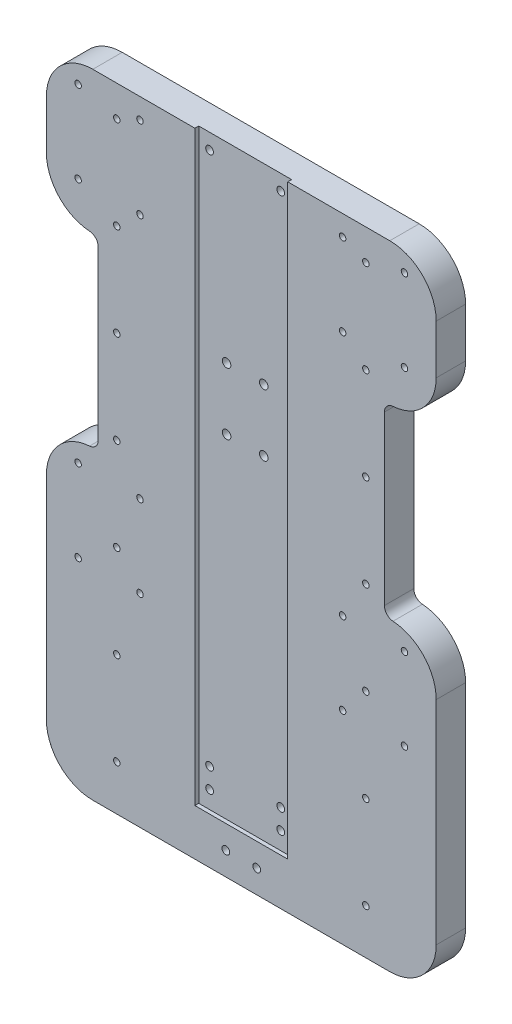
from build123d import *

# Parameters (mm, degrees)
SCHIZZO1_W                       = 252
SCHIZZO1_H                       = 500
ESTRUSIONE_ESTRUSIONE1_DEPTH     = 19
SCHIZZO3_W                       = 60
SCHIZZO3_H                       = 2.5
TAGLIO_ESTRUSIONE1_DEPTH         = 516.981588819
TAP_DRILL_FOR_M5_TAP2_AT_2_COUNT = 2
TAP_DRILL_FOR_M5_TAP2_AT_2_PITCH = 60
TAP_DRILL_FOR_M5_TAP2_AT_3_COUNT = 2
TAP_DRILL_FOR_M5_TAP2_AT_3_PITCH = 120
TAP_DRILL_FOR_M5_TAP2_AT_4_COUNT = 2
TAP_DRILL_FOR_M5_TAP2_AT_4_PITCH = 180
TAP_DRILL_FOR_M5_TAP2_AT_5_COUNT = 2
TAP_DRILL_FOR_M5_TAP2_AT_5_PITCH = 240
TAP_DRILL_FOR_M5_TAP2_AT_6_COUNT = 2
TAP_DRILL_FOR_M5_TAP2_AT_6_PITCH = 300
TAP_DRILL_FOR_M5_TAP2_AT_7_COUNT = 2
TAP_DRILL_FOR_M5_TAP2_AT_7_PITCH = 360
TAP_DRILL_FOR_M5_TAP1_AT_2_COUNT = 2
TAP_DRILL_FOR_M5_TAP1_AT_2_PITCH = 40
TAP_DRILL_FOR_M5_TAP1_AT_3_COUNT = 2
TAP_DRILL_FOR_M5_TAP1_AT_3_PITCH = 53
TAP_DRILL_FOR_M5_TAP1_AT_4_COUNT = 2
TAP_DRILL_FOR_M5_TAP1_AT_4_PITCH = 66.400301204
TAP_DRILL_FOR_M5_TAP1_AT_5_COUNT = 2
TAP_DRILL_FOR_M5_TAP1_AT_5_PITCH = 265.000000001
TAP_DRILL_FOR_M5_TAP1_AT_6_COUNT = 2
TAP_DRILL_FOR_M5_TAP1_AT_6_PITCH = 268.001865666
TAP_DRILL_FOR_M5_TAP1_AT_7_COUNT = 2
TAP_DRILL_FOR_M5_TAP1_AT_7_PITCH = 215.740584963
TAP_DRILL_FOR_M5_TAP1_AT_8_COUNT = 2
TAP_DRILL_FOR_M5_TAP1_AT_8_PITCH = 212.000000001
TAP_DRILL_FOR_M6_TAP4_D          = 5
TAP_DRILL_FOR_M6_TAP4_DEPTH      = 36.6
TAP_DRILL_FOR_M6_TAP4_TIP        = 1.502151548
SKETCH16_W                       = 252
SKETCH16_H                       = 158.679931771
CUT_EXTRUDE1_DEPTH               = 28
SKETCH26_W                       = 60
SKETCH26_H                       = 30
BOSS_EXTRUDE1_DEPTH              = 2.5
M5_CLEARANCE_HOLE1_D             = 5.5
TAP_DRILL_FOR_M6_TAP2_D          = 5
TAP_DRILL_FOR_M6_TAP2_DEPTH      = 30
TAP_DRILL_FOR_M6_TAP2_TIP        = 1.502151548
TAP_DRILL_FOR_M6_TAP3_D          = 5
SKETCH27_W                       = 33.5
SKETCH27_H                       = 120.140011943
CUT_EXTRUDE2_DEPTH               = 76.991082214
FILLET1_R                        = 30
FILLET2_R                        = 30
FILLET3_R                        = 6
SKETCH28_W                       = 64
SKETCH28_H                       = 56
CUT_EXTRUDE3_DEPTH               = 2


with BuildPart() as part:
    # Schizzo1 → Estrusione-Estrusione1 (new body)
    with BuildSketch(Plane.XY):
        Rectangle(SCHIZZO1_W, SCHIZZO1_H)
    extrude(amount=ESTRUSIONE_ESTRUSIONE1_DEPTH)

    # Schizzo3 → Taglio-Estrusione1 (cut, through all)
    with BuildSketch(Plane(origin=(0, 250, 0), x_dir=(1, 0, 0), z_dir=(0, 1, 0))):
        with Locations((0, -17.75)):
            Rectangle(SCHIZZO3_W, SCHIZZO3_H)
    extrude(amount=-TAGLIO_ESTRUSIONE1_DEPTH, mode=Mode.SUBTRACT)

    # Sketch8 → Tap Drill for M5 Tap2 (revolve, cut)
    with BuildSketch(Plane(origin=(80.500605801, -130, 19), x_dir=(0, -1, 0), z_dir=(1, 0, 0))):
        Polygon((0, 0), (0, 37.8618073), (2.1, 36.6), (2.1, 0), align=None)
    tap_drill_for_m5_tap2 = revolve(axis=Axis((80.500605801, -130, 25.35), (0, 0, -1)), mode=Mode.SUBTRACT)

    # Tap Drill for M5 Tap2 at 2: Tap Drill for M5 Tap2 ×2
    with Locations(*[(0, i * TAP_DRILL_FOR_M5_TAP2_AT_2_PITCH, 0) for i in range(1, TAP_DRILL_FOR_M5_TAP2_AT_2_COUNT)]):
        add(tap_drill_for_m5_tap2, mode=Mode.SUBTRACT)

    # Tap Drill for M5 Tap2 at 3: Tap Drill for M5 Tap2 ×2
    with Locations(*[(0, i * TAP_DRILL_FOR_M5_TAP2_AT_3_PITCH, 0) for i in range(1, TAP_DRILL_FOR_M5_TAP2_AT_3_COUNT)]):
        add(tap_drill_for_m5_tap2, mode=Mode.SUBTRACT)

    # Tap Drill for M5 Tap2 at 4: Tap Drill for M5 Tap2 ×2
    with Locations(*[(0, i * TAP_DRILL_FOR_M5_TAP2_AT_4_PITCH, 0) for i in range(1, TAP_DRILL_FOR_M5_TAP2_AT_4_COUNT)]):
        add(tap_drill_for_m5_tap2, mode=Mode.SUBTRACT)

    # Tap Drill for M5 Tap2 at 5: Tap Drill for M5 Tap2 ×2
    with Locations(*[(0, i * TAP_DRILL_FOR_M5_TAP2_AT_5_PITCH, 0) for i in range(1, TAP_DRILL_FOR_M5_TAP2_AT_5_COUNT)]):
        add(tap_drill_for_m5_tap2, mode=Mode.SUBTRACT)

    # Tap Drill for M5 Tap2 at 6: Tap Drill for M5 Tap2 ×2
    with Locations(*[(0, i * TAP_DRILL_FOR_M5_TAP2_AT_6_PITCH, 0) for i in range(1, TAP_DRILL_FOR_M5_TAP2_AT_6_COUNT)]):
        add(tap_drill_for_m5_tap2, mode=Mode.SUBTRACT)

    # Tap Drill for M5 Tap2 at 7: Tap Drill for M5 Tap2 ×2
    with Locations(*[(0, i * TAP_DRILL_FOR_M5_TAP2_AT_7_PITCH, 0) for i in range(1, TAP_DRILL_FOR_M5_TAP2_AT_7_COUNT)]):
        add(tap_drill_for_m5_tap2, mode=Mode.SUBTRACT)

    # Sketch15 → Tap Drill for M5 Tap1 (revolve, cut)
    with BuildSketch(Plane(origin=(105.5, 236.808299653, 19), x_dir=(0, -1, 0), z_dir=(1, 0, 0))):
        Polygon((0, 0), (0, 37.8618073), (2.1, 36.6), (2.1, 0), align=None)
    tap_drill_for_m5_tap1 = revolve(axis=Axis((105.5, 236.808299653, 25.35), (0, 0, -1)), mode=Mode.SUBTRACT)

    # Tap Drill for M5 Tap1 at 2: Tap Drill for M5 Tap1 ×2
    with Locations(*[(-i * TAP_DRILL_FOR_M5_TAP1_AT_2_PITCH, 0, 0) for i in range(1, TAP_DRILL_FOR_M5_TAP1_AT_2_COUNT)]):
        add(tap_drill_for_m5_tap1, mode=Mode.SUBTRACT)

    # Tap Drill for M5 Tap1 at 3: Tap Drill for M5 Tap1 ×2
    with Locations(*[(0, -i * TAP_DRILL_FOR_M5_TAP1_AT_3_PITCH, 0) for i in range(1, TAP_DRILL_FOR_M5_TAP1_AT_3_COUNT)]):
        add(tap_drill_for_m5_tap1, mode=Mode.SUBTRACT)

    # Tap Drill for M5 Tap1 at 4: Tap Drill for M5 Tap1 ×2
    with Locations(*[Vector(-0.6024069059118708, -0.7981891503332318, 0) * (i * TAP_DRILL_FOR_M5_TAP1_AT_4_PITCH) for i in range(1, TAP_DRILL_FOR_M5_TAP1_AT_4_COUNT)]):
        add(tap_drill_for_m5_tap1, mode=Mode.SUBTRACT)

    # Tap Drill for M5 Tap1 at 5: Tap Drill for M5 Tap1 ×2
    with Locations(*[(0, -i * TAP_DRILL_FOR_M5_TAP1_AT_5_PITCH, 0) for i in range(1, TAP_DRILL_FOR_M5_TAP1_AT_5_COUNT)]):
        add(tap_drill_for_m5_tap1, mode=Mode.SUBTRACT)

    # Tap Drill for M5 Tap1 at 6: Tap Drill for M5 Tap1 ×2
    with Locations(*[Vector(-0.14925269232961785, -0.9887990866866536, 0) * (i * TAP_DRILL_FOR_M5_TAP1_AT_6_PITCH) for i in range(1, TAP_DRILL_FOR_M5_TAP1_AT_6_COUNT)]):
        add(tap_drill_for_m5_tap1, mode=Mode.SUBTRACT)

    # Tap Drill for M5 Tap1 at 7: Tap Drill for M5 Tap1 ×2
    with Locations(*[Vector(-0.18540785919716044, -0.9826616537485963, 0) * (i * TAP_DRILL_FOR_M5_TAP1_AT_7_PITCH) for i in range(1, TAP_DRILL_FOR_M5_TAP1_AT_7_COUNT)]):
        add(tap_drill_for_m5_tap1, mode=Mode.SUBTRACT)

    # Tap Drill for M5 Tap1 at 8: Tap Drill for M5 Tap1 ×2
    with Locations(*[(0, -i * TAP_DRILL_FOR_M5_TAP1_AT_8_PITCH, 0) for i in range(1, TAP_DRILL_FOR_M5_TAP1_AT_8_COUNT)]):
        add(tap_drill_for_m5_tap1, mode=Mode.SUBTRACT)

    # Tap Drill for M6 Tap4
    with Locations(Plane.XY.offset(16.5)):
        with Locations((23, -118), (23, -105), (-23, -118), (-23, -105), (23, 240), (-23, 240)):
            Hole(TAP_DRILL_FOR_M6_TAP4_D / 2, depth=TAP_DRILL_FOR_M6_TAP4_DEPTH)
            with Locations((0, 0, -(TAP_DRILL_FOR_M6_TAP4_DEPTH + TAP_DRILL_FOR_M6_TAP4_TIP / 2))):  # 118° drill point
                Cone(0, TAP_DRILL_FOR_M6_TAP4_D / 2, TAP_DRILL_FOR_M6_TAP4_TIP, mode=Mode.SUBTRACT)

    # Mirror1: Tap Drill for M5 Tap2 across plane
    add(tap_drill_for_m5_tap2.mirror(Plane.ZY), mode=Mode.SUBTRACT)

    # Mirror1 copy 1 sketch → Mirror1 copy 1 (revolve, cut)
    with BuildSketch(Plane(origin=(-80.500605801, -70, 19), x_dir=(0, -1, 0), z_dir=(-1, 0, 0))):
        Polygon((0, 0), (0, -37.8618073), (2.1, -36.6), (2.1, 0), align=None)
    revolve(axis=Axis((-80.500605801, -70, 25.35), (0, 0, 1)), mode=Mode.SUBTRACT)

    # Mirror1 copy 2 sketch → Mirror1 copy 2 (revolve, cut)
    with BuildSketch(Plane(origin=(-80.500605801, -10, 19), x_dir=(0, -1, 0), z_dir=(-1, 0, 0))):
        Polygon((0, 0), (0, -37.8618073), (2.1, -36.6), (2.1, 0), align=None)
    revolve(axis=Axis((-80.500605801, -10, 25.35), (0, 0, 1)), mode=Mode.SUBTRACT)

    # Mirror1 copy 3 sketch → Mirror1 copy 3 (revolve, cut)
    with BuildSketch(Plane(origin=(-80.500605801, 50, 19), x_dir=(0, -1, 0), z_dir=(-1, 0, 0))):
        Polygon((0, 0), (0, -37.8618073), (2.1, -36.6), (2.1, 0), align=None)
    revolve(axis=Axis((-80.500605801, 50, 25.35), (0, 0, 1)), mode=Mode.SUBTRACT)

    # Mirror1 copy 4 sketch → Mirror1 copy 4 (revolve, cut)
    with BuildSketch(Plane(origin=(-80.500605801, 110, 19), x_dir=(0, -1, 0), z_dir=(-1, 0, 0))):
        Polygon((0, 0), (0, -37.8618073), (2.1, -36.6), (2.1, 0), align=None)
    revolve(axis=Axis((-80.500605801, 110, 25.35), (0, 0, 1)), mode=Mode.SUBTRACT)

    # Mirror1 copy 5 sketch → Mirror1 copy 5 (revolve, cut)
    with BuildSketch(Plane(origin=(-80.500605801, 170, 19), x_dir=(0, -1, 0), z_dir=(-1, 0, 0))):
        Polygon((0, 0), (0, -37.8618073), (2.1, -36.6), (2.1, 0), align=None)
    revolve(axis=Axis((-80.500605801, 170, 25.35), (0, 0, 1)), mode=Mode.SUBTRACT)

    # Mirror1 copy 6 sketch → Mirror1 copy 6 (revolve, cut)
    with BuildSketch(Plane(origin=(-80.500605801, 230, 19), x_dir=(0, -1, 0), z_dir=(-1, 0, 0))):
        Polygon((0, 0), (0, -37.8618073), (2.1, -36.6), (2.1, 0), align=None)
    revolve(axis=Axis((-80.500605801, 230, 25.35), (0, 0, 1)), mode=Mode.SUBTRACT)

    # Mirror2: Tap Drill for M5 Tap1 across plane
    add(tap_drill_for_m5_tap1.mirror(Plane.ZY), mode=Mode.SUBTRACT)

    # Mirror2 copy 1 sketch → Mirror2 copy 1 (revolve, cut)
    with BuildSketch(Plane(origin=(-65.5, 236.808299653, 19), x_dir=(0, -1, 0), z_dir=(-1, 0, 0))):
        Polygon((0, 0), (0, -37.8618073), (2.1, -36.6), (2.1, 0), align=None)
    revolve(axis=Axis((-65.5, 236.808299653, 25.35), (0, 0, 1)), mode=Mode.SUBTRACT)

    # Mirror2 copy 2 sketch → Mirror2 copy 2 (revolve, cut)
    with BuildSketch(Plane(origin=(-105.5, 183.808299653, 19), x_dir=(0, -1, 0), z_dir=(-1, 0, 0))):
        Polygon((0, 0), (0, -37.8618073), (2.1, -36.6), (2.1, 0), align=None)
    revolve(axis=Axis((-105.5, 183.808299653, 25.35), (0, 0, 1)), mode=Mode.SUBTRACT)

    # Mirror2 copy 3 sketch → Mirror2 copy 3 (revolve, cut)
    with BuildSketch(Plane(origin=(-65.5, 183.808299653, 19), x_dir=(0, -1, 0), z_dir=(-1, 0, 0))):
        Polygon((0, 0), (0, -37.8618073), (2.1, -36.6), (2.1, 0), align=None)
    revolve(axis=Axis((-65.5, 183.808299653, 25.35), (0, 0, 1)), mode=Mode.SUBTRACT)

    # Mirror2 copy 4 sketch → Mirror2 copy 4 (revolve, cut)
    with BuildSketch(Plane(origin=(-105.5, -28.191700348, 19), x_dir=(0, -1, 0), z_dir=(-1, 0, 0))):
        Polygon((0, 0), (0, -37.8618073), (2.1, -36.6), (2.1, 0), align=None)
    revolve(axis=Axis((-105.5, -28.191700348, 25.35), (0, 0, 1)), mode=Mode.SUBTRACT)

    # Mirror2 copy 5 sketch → Mirror2 copy 5 (revolve, cut)
    with BuildSketch(Plane(origin=(-65.5, -28.191700348, 19), x_dir=(0, -1, 0), z_dir=(-1, 0, 0))):
        Polygon((0, 0), (0, -37.8618073), (2.1, -36.6), (2.1, 0), align=None)
    revolve(axis=Axis((-65.5, -28.191700348, 25.35), (0, 0, 1)), mode=Mode.SUBTRACT)

    # Mirror2 copy 6 sketch → Mirror2 copy 6 (revolve, cut)
    with BuildSketch(Plane(origin=(-65.5, 24.808299652, 19), x_dir=(0, -1, 0), z_dir=(-1, 0, 0))):
        Polygon((0, 0), (0, -37.8618073), (2.1, -36.6), (2.1, 0), align=None)
    revolve(axis=Axis((-65.5, 24.808299652, 25.35), (0, 0, 1)), mode=Mode.SUBTRACT)

    # Mirror2 copy 7 sketch → Mirror2 copy 7 (revolve, cut)
    with BuildSketch(Plane(origin=(-105.5, 24.808299652, 19), x_dir=(0, -1, 0), z_dir=(-1, 0, 0))):
        Polygon((0, 0), (0, -37.8618073), (2.1, -36.6), (2.1, 0), align=None)
    revolve(axis=Axis((-105.5, 24.808299652, 25.35), (0, 0, 1)), mode=Mode.SUBTRACT)

    # Sketch16 → Cut-Extrude1 (cut)
    with BuildSketch(Plane(origin=(0, 0, 0), x_dir=(-1, 0, 0), z_dir=(0, 0, -1))):
        with Locations((0, -238.589965886)):
            Rectangle(SKETCH16_W, SKETCH16_H)
    extrude(amount=-CUT_EXTRUDE1_DEPTH, mode=Mode.SUBTRACT)

    # Sketch26 → Boss-Extrude1 (add)
    with BuildSketch(Plane.XY.offset(16.5)):
        with Locations((0, -144.25)):
            Rectangle(SKETCH26_W, SKETCH26_H)
    extrude(amount=BOSS_EXTRUDE1_DEPTH)

    # M5 Clearance Hole1 (through all)
    with Locations(Plane.XY.offset(16.5)):
        with Locations((-12, 86.308299651), (12, 86.308299651), (12, 126.308299651), (-12, 126.308299651)):
            Hole(M5_CLEARANCE_HOLE1_D / 2)

    # Tap Drill for M6 Tap2
    with Locations(Plane(origin=(0, -159.25, 0), x_dir=(-1, 0, 0), z_dir=(0, -1, 0))):
        with Locations((20, -7.125), (-20, -7.125)):
            Hole(TAP_DRILL_FOR_M6_TAP2_D / 2, depth=TAP_DRILL_FOR_M6_TAP2_DEPTH)
            with Locations((0, 0, -(TAP_DRILL_FOR_M6_TAP2_DEPTH + TAP_DRILL_FOR_M6_TAP2_TIP / 2))):  # 118° drill point
                Cone(0, TAP_DRILL_FOR_M6_TAP2_D / 2, TAP_DRILL_FOR_M6_TAP2_TIP, mode=Mode.SUBTRACT)

    # Tap Drill for M6 Tap3 (through all)
    with Locations(Plane(origin=(0, 0, 0), x_dir=(-1, 0, 0), z_dir=(0, 0, -1))):
        with Locations((-10, -144.25), (10, -144.25)):
            Hole(TAP_DRILL_FOR_M6_TAP3_D / 2)

    # Sketch27 → Cut-Extrude2 (cut)
    with BuildSketch(Plane.XY.offset(19)):
        with Locations((109.25, 98.152026033)):
            Rectangle(SKETCH27_W, SKETCH27_H)
        with Locations((-109.25, 98.152026033)):
            Rectangle(SKETCH27_W, SKETCH27_H)
    extrude(amount=-CUT_EXTRUDE2_DEPTH, mode=Mode.SUBTRACT)

    # Fillet1
    fillet1_edges = [part.edges().sort_by_distance(p)[0] for p in [
        (126, 158.222032004, 9.5),
        (126, 38.082020061, 9.5),
        (-126, 158.222032004, 9.5),
        (-126, 38.082020061, 9.5),
    ]]
    fillet(fillet1_edges, radius=FILLET1_R)

    # Fillet2
    fillet2_edges = [part.edges().sort_by_distance(p)[0] for p in [
        (-126, -159.25, 9.5),
        (126, -159.25, 9.5),
        (-126, 250, 9.5),
        (126, 250, 9.5),
    ]]
    fillet(fillet2_edges, radius=FILLET2_R)

    # Fillet3
    fillet3_edges = [part.edges().sort_by_distance(p)[0] for p in [
        (92.5, 158.222032004, 9.5),
        (92.5, 38.082020061, 9.5),
        (-92.5, 38.082020061, 9.5),
        (-92.5, 158.222032004, 9.5),
    ]]
    fillet(fillet3_edges, radius=FILLET3_R)

    # Sketch28 → Cut-Extrude3 (cut)
    with BuildSketch(Plane(origin=(0, 0, 0), x_dir=(-1, 0, 0), z_dir=(0, 0, -1))):
        with Locations((0, 106.308299651)):
            Rectangle(SKETCH28_W, SKETCH28_H)
    extrude(amount=-CUT_EXTRUDE3_DEPTH, mode=Mode.SUBTRACT)


solid = part.part
